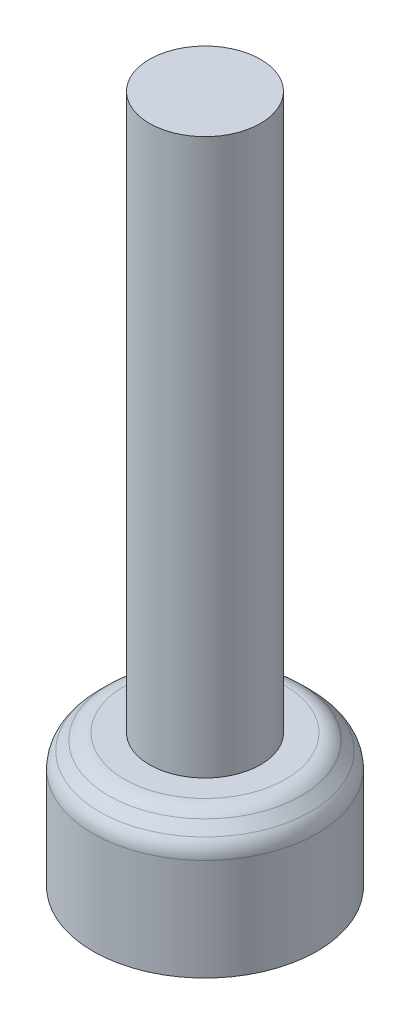
from build123d import *

# Parameters (mm, degrees)
SKETCH2_R           = 5
BOSS_EXTRUDE1_DEPTH = 50
SKETCH3_R           = 10.087575419
BOSS_EXTRUDE2_DEPTH = 12
CHAMFER1_SIZE       = 2
FILLET2_R           = 2
FILLET3_R           = 2


with BuildPart() as part:
    # Sketch2 → Boss-Extrude1 (new body)
    with BuildSketch(Plane(origin=(0, 0, 0), x_dir=(1, 0, 0), z_dir=(0, 1, 0))):
        with Locations(Location((0, 0, 0), (0, 0, 270))):
            Circle(SKETCH2_R)
    extrude(amount=BOSS_EXTRUDE1_DEPTH)

    # Sketch3 → Boss-Extrude2 (add)
    with BuildSketch(Plane.XZ):
        with Locations(Location((0, 0, 0), (0, 0, 270))):
            Circle(SKETCH3_R)
    extrude(amount=BOSS_EXTRUDE2_DEPTH)

    # Chamfer1
    chamfer1_edges = [part.edges().sort_by_distance(p)[0] for p in [
        (0, 0, 10.087575419),
    ]]
    chamfer(chamfer1_edges, length=CHAMFER1_SIZE)

    # Fillet2
    fillet2_edges = [part.edges().sort_by_distance(p)[0] for p in [
        (0, 0, 8.087575419),
    ]]
    fillet(fillet2_edges, radius=FILLET2_R)

    # Fillet3
    fillet3_edges = [part.edges().sort_by_distance(p)[0] for p in [
        (0, -2, 10.087575419),
    ]]
    fillet(fillet3_edges, radius=FILLET3_R)


solid = part.part
